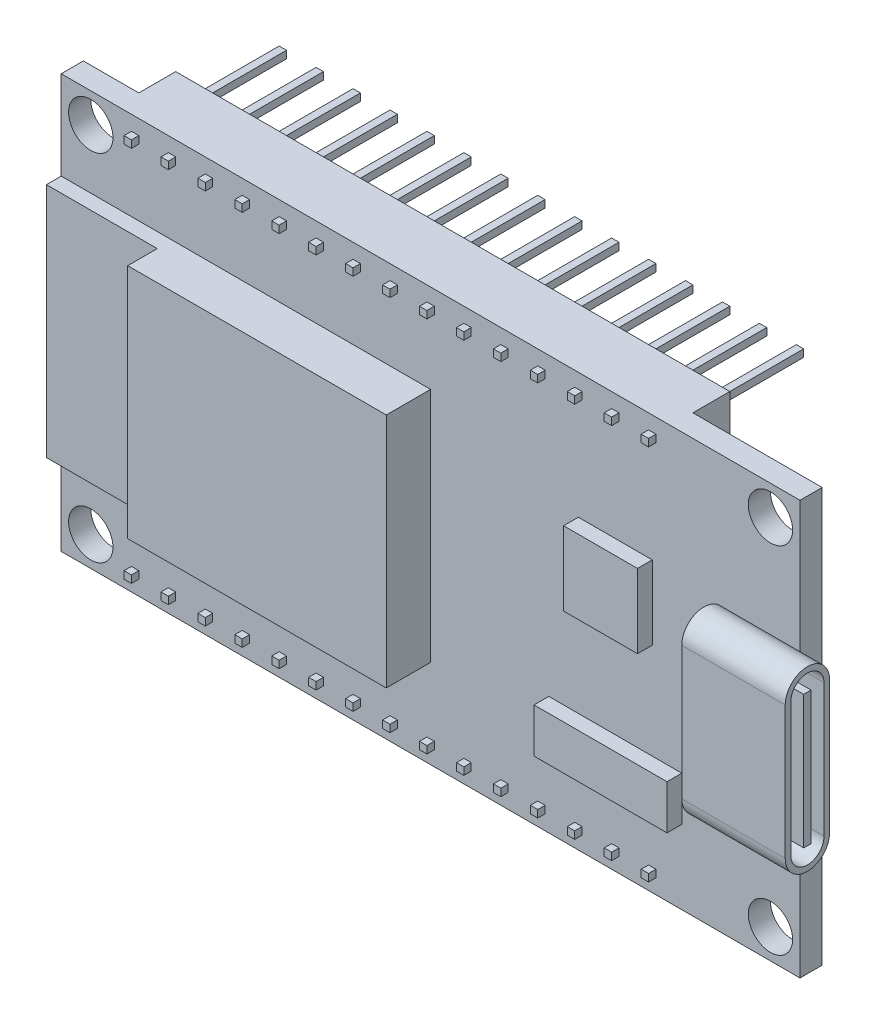
from build123d import *

# Parameters (mm, degrees)
SKETCH1_R                = 1.5
BOSS_EXTRUDE1_DEPTH      = 0.75
BOSS_EXTRUDE2_DEPTH      = 7
SKETCH8_W                = 0.5
SKETCH8_H                = 0.5
SKETCH8_W_2              = 37.5
SKETCH8_H_2              = 2.5
BOSS_EXTRUDE3_DEPTH      = 4
BOSS_EXTRUDE4_START      = -10
SKETCH8_3_W              = 0.5
SKETCH8_3_H              = 0.5
BOSS_EXTRUDE4_DEPTH      = 10.5
LPATTERN1_COUNT          = 15
LPATTERN1_PITCH          = 2.5
MIRROR1_START            = -10
MIRROR1_COPY_1_SKETCH_W  = 0.5
MIRROR1_COPY_1_SKETCH_H  = 0.5
MIRROR1_COPY_1_DEPTH     = 10.5
MIRROR1_COPY_2_SKETCH_W  = 0.5
MIRROR1_COPY_2_SKETCH_H  = 0.5
MIRROR1_COPY_2_DEPTH     = 10.5
MIRROR1_COPY_3_SKETCH_W  = 0.5
MIRROR1_COPY_3_SKETCH_H  = 0.5
MIRROR1_COPY_3_DEPTH     = 10.5
MIRROR1_COPY_4_SKETCH_W  = 0.5
MIRROR1_COPY_4_SKETCH_H  = 0.5
MIRROR1_COPY_4_DEPTH     = 10.5
MIRROR1_COPY_5_SKETCH_W  = 0.5
MIRROR1_COPY_5_SKETCH_H  = 0.5
MIRROR1_COPY_5_DEPTH     = 10.5
MIRROR1_COPY_6_SKETCH_W  = 0.5
MIRROR1_COPY_6_SKETCH_H  = 0.5
MIRROR1_COPY_6_DEPTH     = 10.5
MIRROR1_COPY_7_SKETCH_W  = 0.5
MIRROR1_COPY_7_SKETCH_H  = 0.5
MIRROR1_COPY_7_DEPTH     = 10.5
MIRROR1_COPY_8_SKETCH_W  = 0.5
MIRROR1_COPY_8_SKETCH_H  = 0.5
MIRROR1_COPY_8_DEPTH     = 10.5
MIRROR1_COPY_9_SKETCH_W  = 0.5
MIRROR1_COPY_9_SKETCH_H  = 0.5
MIRROR1_COPY_9_DEPTH     = 10.5
MIRROR1_COPY_10_SKETCH_W = 0.5
MIRROR1_COPY_10_SKETCH_H = 0.5
MIRROR1_COPY_10_DEPTH    = 10.5
MIRROR1_COPY_11_SKETCH_W = 0.5
MIRROR1_COPY_11_SKETCH_H = 0.5
MIRROR1_COPY_11_DEPTH    = 10.5
MIRROR1_COPY_12_SKETCH_W = 0.5
MIRROR1_COPY_12_SKETCH_H = 0.5
MIRROR1_COPY_12_DEPTH    = 10.5
MIRROR1_COPY_13_SKETCH_W = 0.5
MIRROR1_COPY_13_SKETCH_H = 0.5
MIRROR1_COPY_13_DEPTH    = 10.5
MIRROR1_COPY_14_SKETCH_W = 0.5
MIRROR1_COPY_14_SKETCH_H = 0.5
MIRROR1_COPY_14_DEPTH    = 10.5
MIRROR1_COPY_15_SKETCH_W = 0.5
MIRROR1_COPY_15_SKETCH_H = 0.5
MIRROR1_COPY_15_DEPTH    = 10.5
SKETCH8_4_W              = 17.5
SKETCH8_4_H              = 16
BOSS_EXTRUDE5_DEPTH      = 3
SKETCH8_5_W              = 7.5
SKETCH8_5_H              = 16
SKETCH8_5_W_2            = 5
SKETCH8_5_H_2            = 5
SKETCH8_5_W_3            = 9
SKETCH8_5_H_3            = 3
BOSS_EXTRUDE6_DEPTH      = 1
SKETCH6_W                = 0.5
SKETCH6_H                = 9
CUT_EXTRUDE4_DEPTH       = 6


with BuildPart() as part:
    # Sketch1 → Boss-Extrude1 (new, symmetric)
    with BuildSketch(Plane.XY):
        Polygon((-25, 14), (-25, -14), (25, -14), (25, 14), (-23, 14), align=None)
        with Locations((-23, -12)):
            Circle(SKETCH1_R, mode=Mode.SUBTRACT)
        with Locations((23, -12)):
            Circle(SKETCH1_R, mode=Mode.SUBTRACT)
        with Locations((-23, 12)):
            Circle(SKETCH1_R, mode=Mode.SUBTRACT)
        with Locations((23, 12)):
            Circle(SKETCH1_R, mode=Mode.SUBTRACT)
    extrude(amount=BOSS_EXTRUDE1_DEPTH, both=True)

    # Sketch5 → Boss-Extrude2 (add)
    with BuildSketch(Plane(origin=(27, 0, 0), x_dir=(0, 0, -1), z_dir=(1, 0, 0))):
        with BuildLine():
            Line((-3.75, 4.5), (-3.75, -4.5))
            ThreePointArc((-3.75, -4.5), (-2.25, -6), (-0.75, -4.5))
            Line((-0.75, -4.5), (-0.75, 0))
            Line((-0.75, 0), (-0.75, 4.5))
            ThreePointArc((-0.75, 4.5), (-2.25, 6), (-3.75, 4.5))
        make_face()
    extrude(amount=-BOSS_EXTRUDE2_DEPTH)

    # Sketch8 → Boss-Extrude3 (add)
    # profile 1 of 2: a face of its own
    with BuildSketch(Plane.XY.offset(0.75)):
        Polygon((16.25, 11.5), (16.25, 14), (15, 14), (-21.25, 14), (-21.25, 11.5), align=None)
        with Locations((-17.5, 12.75)):
            Rectangle(SKETCH8_W, SKETCH8_H, mode=Mode.SUBTRACT)
        with Locations((-20, 12.75)):
            Rectangle(SKETCH8_W, SKETCH8_H, mode=Mode.SUBTRACT)
        with Locations((-15, 12.75)):
            Rectangle(SKETCH8_W, SKETCH8_H, mode=Mode.SUBTRACT)
        with Locations((-12.5, 12.75)):
            Rectangle(SKETCH8_W, SKETCH8_H, mode=Mode.SUBTRACT)
        with Locations((-10, 12.75)):
            Rectangle(SKETCH8_W, SKETCH8_H, mode=Mode.SUBTRACT)
        with Locations((-7.5, 12.75)):
            Rectangle(SKETCH8_W, SKETCH8_H, mode=Mode.SUBTRACT)
        with Locations((-5, 12.75)):
            Rectangle(SKETCH8_W, SKETCH8_H, mode=Mode.SUBTRACT)
        with Locations((0, 12.75)):
            Rectangle(SKETCH8_W, SKETCH8_H, mode=Mode.SUBTRACT)
        with Locations((2.5, 12.75)):
            Rectangle(SKETCH8_W, SKETCH8_H, mode=Mode.SUBTRACT)
        with Locations((5, 12.75)):
            Rectangle(SKETCH8_W, SKETCH8_H, mode=Mode.SUBTRACT)
        with Locations((7.5, 12.75)):
            Rectangle(SKETCH8_W, SKETCH8_H, mode=Mode.SUBTRACT)
        with Locations((10, 12.75)):
            Rectangle(SKETCH8_W, SKETCH8_H, mode=Mode.SUBTRACT)
        with Locations((12.5, 12.75)):
            Rectangle(SKETCH8_W, SKETCH8_H, mode=Mode.SUBTRACT)
        Polygon((14.75, 13), (15, 13), (15.25, 13), (15.25, 12.5), (14.75, 12.5), align=None, mode=Mode.SUBTRACT)
    # profile 2 of 2: a face of its own
    with BuildSketch(Plane.XY.offset(0.75)):
        with Locations((-2.5, -12.75)):
            Rectangle(SKETCH8_W_2, SKETCH8_H_2)
        with Locations((15, -12.75)):
            Rectangle(SKETCH8_W, SKETCH8_H, mode=Mode.SUBTRACT)
        with Locations((12.5, -12.75)):
            Rectangle(SKETCH8_W, SKETCH8_H, mode=Mode.SUBTRACT)
        with Locations((10, -12.75)):
            Rectangle(SKETCH8_W, SKETCH8_H, mode=Mode.SUBTRACT)
        with Locations((7.5, -12.75)):
            Rectangle(SKETCH8_W, SKETCH8_H, mode=Mode.SUBTRACT)
        with Locations((5, -12.75)):
            Rectangle(SKETCH8_W, SKETCH8_H, mode=Mode.SUBTRACT)
        with Locations((2.5, -12.75)):
            Rectangle(SKETCH8_W, SKETCH8_H, mode=Mode.SUBTRACT)
        with Locations((0, -12.75)):
            Rectangle(SKETCH8_W, SKETCH8_H, mode=Mode.SUBTRACT)
        with Locations((-2.5, -12.75)):
            Rectangle(SKETCH8_W, SKETCH8_H, mode=Mode.SUBTRACT)
        with Locations((-5, -12.75)):
            Rectangle(SKETCH8_W, SKETCH8_H, mode=Mode.SUBTRACT)
        with Locations((-7.5, -12.75)):
            Rectangle(SKETCH8_W, SKETCH8_H, mode=Mode.SUBTRACT)
        with Locations((-10, -12.75)):
            Rectangle(SKETCH8_W, SKETCH8_H, mode=Mode.SUBTRACT)
        with Locations((-12.5, -12.75)):
            Rectangle(SKETCH8_W, SKETCH8_H, mode=Mode.SUBTRACT)
        with Locations((-15, -12.75)):
            Rectangle(SKETCH8_W, SKETCH8_H, mode=Mode.SUBTRACT)
        with Locations((-17.5, -12.75)):
            Rectangle(SKETCH8_W, SKETCH8_H, mode=Mode.SUBTRACT)
        with Locations((-20, -12.75)):
            Rectangle(SKETCH8_W, SKETCH8_H, mode=Mode.SUBTRACT)
    extrude(amount=-BOSS_EXTRUDE3_DEPTH)

    # Sketch8<3> → Boss-Extrude4 (add)
    with BuildSketch(Plane.XY.offset(0.75).offset(BOSS_EXTRUDE4_START)):
        with Locations((15, -12.75)):
            Rectangle(SKETCH8_3_W, SKETCH8_3_H)
    boss_extrude4 = extrude(amount=BOSS_EXTRUDE4_DEPTH)

    # LPattern1: Boss-Extrude4 ×15
    with Locations(*[(-i * LPATTERN1_PITCH, 0, 0) for i in range(1, LPATTERN1_COUNT)]):
        add(boss_extrude4)

    # Mirror1 copy 1 sketch → Mirror1 copy 1 (add)
    with BuildSketch(Plane(origin=(-2.5, 0, 0.75), x_dir=(1, 0, 0), z_dir=(0, 0, 1)).offset(MIRROR1_START)):
        with Locations((15, 12.75)):
            Rectangle(MIRROR1_COPY_1_SKETCH_W, MIRROR1_COPY_1_SKETCH_H)
    extrude(amount=MIRROR1_COPY_1_DEPTH)

    # Mirror1 copy 2 sketch → Mirror1 copy 2 (add)
    with BuildSketch(Plane(origin=(-5, 0, 0.75), x_dir=(1, 0, 0), z_dir=(0, 0, 1)).offset(MIRROR1_START)):
        with Locations((15, 12.75)):
            Rectangle(MIRROR1_COPY_2_SKETCH_W, MIRROR1_COPY_2_SKETCH_H)
    extrude(amount=MIRROR1_COPY_2_DEPTH)

    # Mirror1 copy 3 sketch → Mirror1 copy 3 (add)
    with BuildSketch(Plane(origin=(-7.5, 0, 0.75), x_dir=(1, 0, 0), z_dir=(0, 0, 1)).offset(MIRROR1_START)):
        with Locations((15, 12.75)):
            Rectangle(MIRROR1_COPY_3_SKETCH_W, MIRROR1_COPY_3_SKETCH_H)
    extrude(amount=MIRROR1_COPY_3_DEPTH)

    # Mirror1 copy 4 sketch → Mirror1 copy 4 (add)
    with BuildSketch(Plane(origin=(-10, 0, 0.75), x_dir=(1, 0, 0), z_dir=(0, 0, 1)).offset(MIRROR1_START)):
        with Locations((15, 12.75)):
            Rectangle(MIRROR1_COPY_4_SKETCH_W, MIRROR1_COPY_4_SKETCH_H)
    extrude(amount=MIRROR1_COPY_4_DEPTH)

    # Mirror1 copy 5 sketch → Mirror1 copy 5 (add)
    with BuildSketch(Plane(origin=(-12.5, 0, 0.75), x_dir=(1, 0, 0), z_dir=(0, 0, 1)).offset(MIRROR1_START)):
        with Locations((15, 12.75)):
            Rectangle(MIRROR1_COPY_5_SKETCH_W, MIRROR1_COPY_5_SKETCH_H)
    extrude(amount=MIRROR1_COPY_5_DEPTH)

    # Mirror1 copy 6 sketch → Mirror1 copy 6 (add)
    with BuildSketch(Plane(origin=(-15, 0, 0.75), x_dir=(1, 0, 0), z_dir=(0, 0, 1)).offset(MIRROR1_START)):
        with Locations((15, 12.75)):
            Rectangle(MIRROR1_COPY_6_SKETCH_W, MIRROR1_COPY_6_SKETCH_H)
    extrude(amount=MIRROR1_COPY_6_DEPTH)

    # Mirror1 copy 7 sketch → Mirror1 copy 7 (add)
    with BuildSketch(Plane(origin=(-17.5, 0, 0.75), x_dir=(1, 0, 0), z_dir=(0, 0, 1)).offset(MIRROR1_START)):
        with Locations((15, 12.75)):
            Rectangle(MIRROR1_COPY_7_SKETCH_W, MIRROR1_COPY_7_SKETCH_H)
    extrude(amount=MIRROR1_COPY_7_DEPTH)

    # Mirror1 copy 8 sketch → Mirror1 copy 8 (add)
    with BuildSketch(Plane(origin=(-20, 0, 0.75), x_dir=(1, 0, 0), z_dir=(0, 0, 1)).offset(MIRROR1_START)):
        with Locations((15, 12.75)):
            Rectangle(MIRROR1_COPY_8_SKETCH_W, MIRROR1_COPY_8_SKETCH_H)
    extrude(amount=MIRROR1_COPY_8_DEPTH)

    # Mirror1 copy 9 sketch → Mirror1 copy 9 (add)
    with BuildSketch(Plane(origin=(-22.5, 0, 0.75), x_dir=(1, 0, 0), z_dir=(0, 0, 1)).offset(MIRROR1_START)):
        with Locations((15, 12.75)):
            Rectangle(MIRROR1_COPY_9_SKETCH_W, MIRROR1_COPY_9_SKETCH_H)
    extrude(amount=MIRROR1_COPY_9_DEPTH)

    # Mirror1 copy 10 sketch → Mirror1 copy 10 (add)
    with BuildSketch(Plane(origin=(-25, 0, 0.75), x_dir=(1, 0, 0), z_dir=(0, 0, 1)).offset(MIRROR1_START)):
        with Locations((15, 12.75)):
            Rectangle(MIRROR1_COPY_10_SKETCH_W, MIRROR1_COPY_10_SKETCH_H)
    extrude(amount=MIRROR1_COPY_10_DEPTH)

    # Mirror1 copy 11 sketch → Mirror1 copy 11 (add)
    with BuildSketch(Plane(origin=(-27.5, 0, 0.75), x_dir=(1, 0, 0), z_dir=(0, 0, 1)).offset(MIRROR1_START)):
        with Locations((15, 12.75)):
            Rectangle(MIRROR1_COPY_11_SKETCH_W, MIRROR1_COPY_11_SKETCH_H)
    extrude(amount=MIRROR1_COPY_11_DEPTH)

    # Mirror1 copy 12 sketch → Mirror1 copy 12 (add)
    with BuildSketch(Plane(origin=(-30, 0, 0.75), x_dir=(1, 0, 0), z_dir=(0, 0, 1)).offset(MIRROR1_START)):
        with Locations((15, 12.75)):
            Rectangle(MIRROR1_COPY_12_SKETCH_W, MIRROR1_COPY_12_SKETCH_H)
    extrude(amount=MIRROR1_COPY_12_DEPTH)

    # Mirror1 copy 13 sketch → Mirror1 copy 13 (add)
    with BuildSketch(Plane(origin=(-32.5, 0, 0.75), x_dir=(1, 0, 0), z_dir=(0, 0, 1)).offset(MIRROR1_START)):
        with Locations((15, 12.75)):
            Rectangle(MIRROR1_COPY_13_SKETCH_W, MIRROR1_COPY_13_SKETCH_H)
    extrude(amount=MIRROR1_COPY_13_DEPTH)

    # Mirror1 copy 14 sketch → Mirror1 copy 14 (add)
    with BuildSketch(Plane(origin=(-35, 0, 0.75), x_dir=(1, 0, 0), z_dir=(0, 0, 1)).offset(MIRROR1_START)):
        with Locations((15, 12.75)):
            Rectangle(MIRROR1_COPY_14_SKETCH_W, MIRROR1_COPY_14_SKETCH_H)
    extrude(amount=MIRROR1_COPY_14_DEPTH)

    # Mirror1 copy 15 sketch → Mirror1 copy 15 (add)
    with BuildSketch(Plane.XY.offset(0.75).offset(MIRROR1_START)):
        with Locations((15, 12.75)):
            Rectangle(MIRROR1_COPY_15_SKETCH_W, MIRROR1_COPY_15_SKETCH_H)
    extrude(amount=MIRROR1_COPY_15_DEPTH)

    # Sketch8<4> → Boss-Extrude5 (add)
    with BuildSketch(Plane.XY.offset(0.75)):
        with Locations((-8.75, 0)):
            Rectangle(SKETCH8_4_W, SKETCH8_4_H)
    extrude(amount=BOSS_EXTRUDE5_DEPTH)

    # Sketch8<5> → Boss-Extrude6 (add)
    with BuildSketch(Plane.XY.offset(0.75)):
        with Locations((-21.25, 0)):
            Rectangle(SKETCH8_5_W, SKETCH8_5_H)
        with Locations((12.5, 3.006377204)):
            Rectangle(SKETCH8_5_W_2, SKETCH8_5_H_2)
        with Locations((12.5, -7.495049505)):
            Rectangle(SKETCH8_5_W_3, SKETCH8_5_H_3)
    extrude(amount=BOSS_EXTRUDE6_DEPTH)

    # Sketch6 → Cut-Extrude4 (cut)
    with BuildSketch(Plane(origin=(27, 0, 0), x_dir=(0, 0, -1), z_dir=(1, 0, 0))):
        with BuildLine():
            ThreePointArc((-1.125, 4.5), (-2.25, 5.625), (-3.375, 4.5))
            Line((-3.375, 4.5), (-3.375, -4.5))
            ThreePointArc((-3.375, -4.5), (-2.25, -5.625), (-1.125, -4.5))
            Line((-1.125, -4.5), (-1.125, 4.5))
        make_face()
        with Locations((-2.25, 0)):
            Rectangle(SKETCH6_W, SKETCH6_H, mode=Mode.SUBTRACT)
    extrude(amount=-CUT_EXTRUDE4_DEPTH, mode=Mode.SUBTRACT)


solid = part.part
